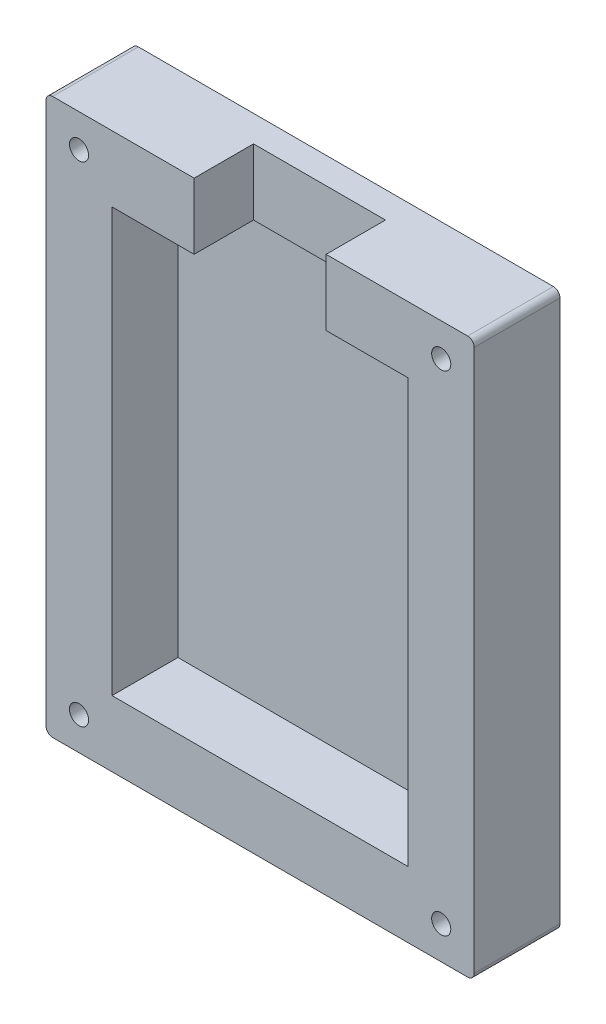
from build123d import *

# Parameters (mm, degrees)
ESQUISSE2_W             = 64.9
ESQUISSE2_H             = 84.149666381
ESQUISSE2_R             = 1.45
ESQUISSE2_W_2           = 44.9
ESQUISSE2_H_2           = 64.15
BOSS_EXTRU_3_DEPTH      = 13
ESQUISSE6_W             = 44.9
ESQUISSE6_H             = 64.15
BOSS_EXTRU_4_DEPTH      = 3
ESQUISSE8_W             = 20
ESQUISSE8_H             = 9
ENL_V_MAT_EXTRU_2_DEPTH = 10
CONG_1_R                = 1
CONG_2_R                = 1
CONG_3_R                = 1
CONG_4_R                = 1


with BuildPart() as part:
    # Esquisse2 → Boss.-Extru.3 (new body)
    with BuildSketch(Plane.XY):
        with Locations((-9.785413718, 8.985039615)):
            Rectangle(ESQUISSE2_W, ESQUISSE2_H)
        with Locations(Location((17.664586282, 46.059872806, 0), (0, 0, 180))):
            Circle(ESQUISSE2_R, mode=Mode.SUBTRACT)
        with Locations(Location((-37.235413718, 46.059872806, 0), (0, 0, 180))):
            Circle(ESQUISSE2_R, mode=Mode.SUBTRACT)
        with Locations(Location((-37.235413718, -28.089793575, 0), (0, 0, 180))):
            Circle(ESQUISSE2_R, mode=Mode.SUBTRACT)
        with Locations(Location((17.664586282, -28.089793575, 0), (0, 0, 180))):
            Circle(ESQUISSE2_R, mode=Mode.SUBTRACT)
        with Locations((-9.785413718, 8.985206425)):
            Rectangle(ESQUISSE2_W_2, ESQUISSE2_H_2, mode=Mode.SUBTRACT)
    extrude(amount=BOSS_EXTRU_3_DEPTH)

    # Esquisse6 → Boss.-Extru.4 (add)
    with BuildSketch(Plane.XY):
        with Locations((-9.785413718, 8.985206425)):
            Rectangle(ESQUISSE6_W, ESQUISSE6_H)
    extrude(amount=BOSS_EXTRU_4_DEPTH)

    # Esquisse8 → Enlèv. mat.-Extru.2 (cut)
    with BuildSketch(Plane.XZ.offset(-41.060206425)):
        with Locations((-9.785413718, 8.5)):
            Rectangle(ESQUISSE8_W, ESQUISSE8_H)
    extrude(amount=-ENL_V_MAT_EXTRU_2_DEPTH, mode=Mode.SUBTRACT)

    # Congé1
    cong_1_edges = [part.edges().sort_by_distance(p)[0] for p in [
        (-42.235413718, 51.059872806, 6.5),
    ]]
    fillet(cong_1_edges, radius=CONG_1_R)

    # Congé2
    cong_2_edges = [part.edges().sort_by_distance(p)[0] for p in [
        (-42.235413718, -33.089793575, 6.5),
    ]]
    fillet(cong_2_edges, radius=CONG_2_R)

    # Congé3
    cong_3_edges = [part.edges().sort_by_distance(p)[0] for p in [
        (22.664586282, -33.089793575, 6.5),
    ]]
    fillet(cong_3_edges, radius=CONG_3_R)

    # Congé4
    cong_4_edges = [part.edges().sort_by_distance(p)[0] for p in [
        (22.664586282, 51.059872806, 6.5),
    ]]
    fillet(cong_4_edges, radius=CONG_4_R)


solid = part.part
